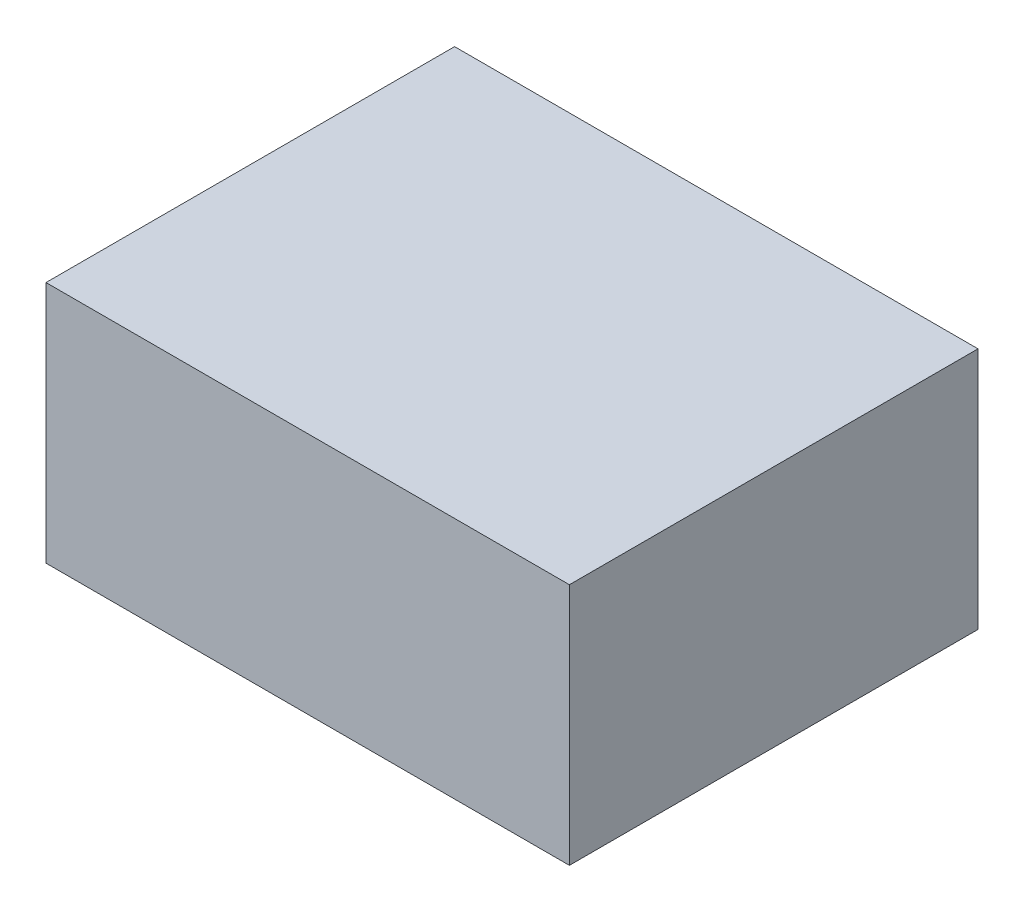
from build123d import *

# Parameters (mm, degrees)
SKETCH1_W           = 107.67345399
SKETCH1_H           = 84.057343264
BOSS_EXTRUDE1_DEPTH = 50


with BuildPart() as part:
    # Sketch1 → Boss-Extrude1 (new body)
    with BuildSketch(Plane(origin=(0, 0, 0), x_dir=(1, 0, 0), z_dir=(0, 1, 0))):
        Rectangle(SKETCH1_W, SKETCH1_H)
    extrude(amount=BOSS_EXTRUDE1_DEPTH)


solid = part.part
